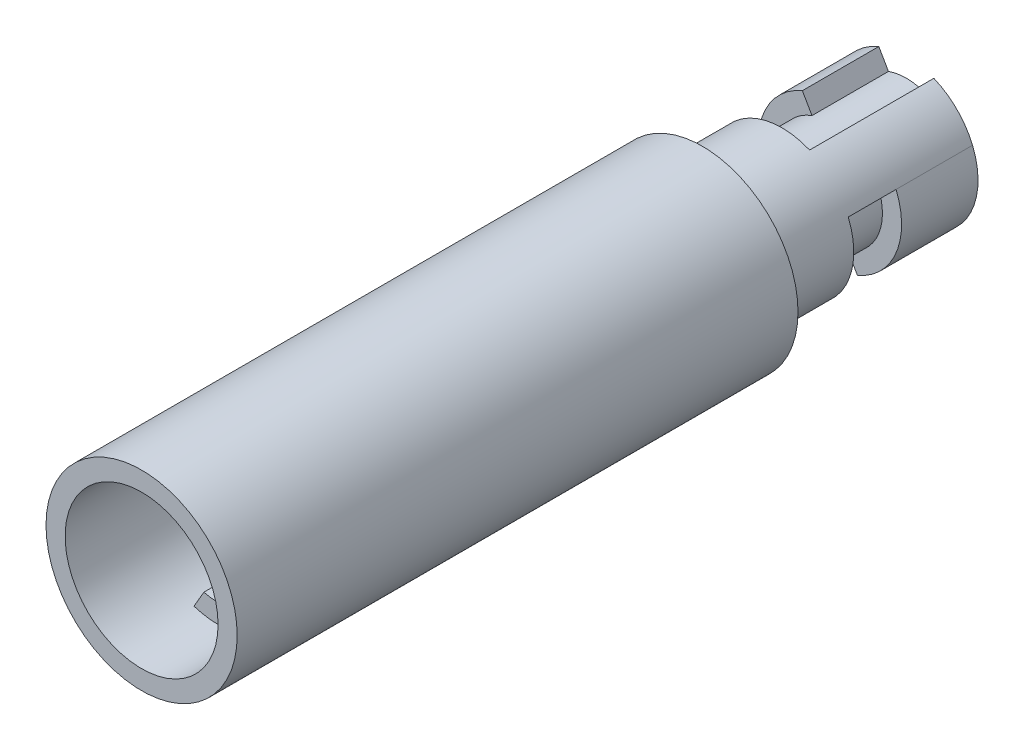
from build123d import *

# Parameters (mm, degrees)
SKETCH1_R           = 6.35
BOSS_EXTRUDE1_DEPTH = 38.1
SKETCH7_R           = 4.7625
BOSS_EXTRUDE2_DEPTH = 12.7
SKETCH8_R           = 5.08
CUT_EXTRUDE1_DEPTH  = 12.7
BOSS_EXTRUDE3_START = -5.08
BOSS_EXTRUDE3_DEPTH = 2.54
CUT_EXTRUDE2_START  = -8.255
CUT_EXTRUDE2_DEPTH  = 8.255
CUT_EXTRUDE3_START  = -8.255
CUT_EXTRUDE3_DEPTH  = 3.175
CUT_EXTRUDE8_START  = -0.846666667
SKETCH13_R          = 6.35
CUT_EXTRUDE8_DEPTH  = 0.846666667


with BuildPart() as part:
    # Sketch1 → Boss-Extrude1 (new body)
    with BuildSketch(Plane.XY):
        with Locations(Location((0, 0, 0), (0, 0, 180))):
            Circle(SKETCH1_R)
    extrude(amount=BOSS_EXTRUDE1_DEPTH)

    # Sketch7 → Boss-Extrude2 (add)
    with BuildSketch(Plane(origin=(0, 0, 0), x_dir=(-1, 0, 0), z_dir=(0, 0, -1))):
        Circle(SKETCH7_R)
    extrude(amount=BOSS_EXTRUDE2_DEPTH)

    # Sketch8 → Cut-Extrude1 (cut)
    with BuildSketch(Plane.XY.offset(38.1)):
        Circle(SKETCH8_R)
    extrude(amount=-CUT_EXTRUDE1_DEPTH, mode=Mode.SUBTRACT)

    # Sketch9 → Boss-Extrude3 (add)
    with BuildSketch(Plane.XY.offset(38.1).offset(BOSS_EXTRUDE3_START)):
        with BuildLine():
            ThreePointArc((-0.943437239, 3.691344765), (0, 3.81), (0.943437239, 3.691344765))
            Line((0.943437239, 3.691344765), (1.596562761, 4.822591352))
            ThreePointArc((1.596562761, 4.822591352), (0, 5.08), (-1.596562761, 4.822591352))
            Line((-1.596562761, 4.822591352), (-0.943437239, 3.691344765))
        make_face()
        with BuildLine():
            Line((1.596562761, -4.822591352), (0.943437239, -3.691344765))
            ThreePointArc((0.943437239, -3.691344765), (0, -3.81), (-0.943437239, -3.691344765))
            Line((-0.943437239, -3.691344765), (-1.596562761, -4.822591352))
            ThreePointArc((-1.596562761, -4.822591352), (0, -5.08), (1.596562761, -4.822591352))
        make_face()
    extrude(amount=-BOSS_EXTRUDE3_DEPTH)

    # Sketch10 → Cut-Extrude2 (cut)
    with BuildSketch(Plane(origin=(0, 0, -12.7), x_dir=(-1, 0, 0), z_dir=(0, 0, -1)).offset(CUT_EXTRUDE2_START)):
        with BuildLine():
            Line((1.828672286, -4.397426966), (1.186321903, -3.284843465))
            ThreePointArc((1.186321903, -3.284843465), (0, -3.4925), (-1.186321903, -3.284843465))
            Line((-1.186321903, -3.284843465), (-1.828672286, -4.397426966))
            ThreePointArc((-1.828672286, -4.397426966), (0, -4.7625), (1.828672286, -4.397426966))
        make_face()
        with BuildLine():
            ThreePointArc((-1.186321903, 3.284843465), (0, 3.4925), (1.186321903, 3.284843465))
            Line((1.186321903, 3.284843465), (1.828672286, 4.397426966))
            ThreePointArc((1.828672286, 4.397426966), (0, 4.7625), (-1.828672286, 4.397426966))
            Line((-1.828672286, 4.397426966), (-1.186321903, 3.284843465))
        make_face()
    extrude(amount=CUT_EXTRUDE2_DEPTH, mode=Mode.SUBTRACT)

    # Sketch11 → Cut-Extrude3 (cut)
    with BuildSketch(Plane(origin=(0, 0, -12.7), x_dir=(-1, 0, 0), z_dir=(0, 0, -1)).offset(CUT_EXTRUDE3_START)):
        with BuildLine():
            ThreePointArc((1.828672286, 4.397426966), (0, 4.7625), (-1.828672286, 4.397426966))
            Line((-1.828672286, 4.397426966), (-1.186321903, 3.284843465))
            ThreePointArc((-1.186321903, 3.284843465), (0, 3.4925), (1.186321903, 3.284843465))
            Line((1.186321903, 3.284843465), (1.828672286, 4.397426966))
        make_face()
        with BuildLine():
            Line((1.828672286, 4.397426966), (1.186321903, 3.284843465))
            ThreePointArc((1.186321903, 3.284843465), (2.469570433, 2.469570433), (3.284843465, 1.186321903))
            ThreePointArc((3.284843465, 1.186321903), (3.440194184, 0.602179561), (3.4925, 0))
            ThreePointArc((3.4925, 0), (3.440194184, -0.602179561), (3.284843465, -1.186321903))
            Line((3.284843465, -1.186321903), (4.397426966, -1.828672286))
            ThreePointArc((4.397426966, -1.828672286), (4.67034004, -0.932378766), (4.7625, 0))
            ThreePointArc((4.7625, 0), (4.67034004, 0.932378766), (4.397426966, 1.828672286))
            ThreePointArc((4.397426966, 1.828672286), (3.367596045, 3.367596045), (1.828672286, 4.397426966))
        make_face()
        with BuildLine():
            ThreePointArc((-1.828672286, -4.397426966), (0, -4.7625), (1.828672286, -4.397426966))
            Line((1.828672286, -4.397426966), (1.186321903, -3.284843465))
            ThreePointArc((1.186321903, -3.284843465), (0, -3.4925), (-1.186321903, -3.284843465))
            Line((-1.186321903, -3.284843465), (-1.828672286, -4.397426966))
        make_face()
        with BuildLine():
            ThreePointArc((-3.284843465, -1.186321903), (-3.4925, 0), (-3.284843465, 1.186321903))
            Line((-3.284843465, 1.186321903), (-4.397426966, 1.828672286))
            ThreePointArc((-4.397426966, 1.828672286), (-4.7625, 0), (-4.397426966, -1.828672286))
            ThreePointArc((-4.397426966, -1.828672286), (-3.367596045, -3.367596045), (-1.828672286, -4.397426966))
            Line((-1.828672286, -4.397426966), (-1.186321903, -3.284843465))
            ThreePointArc((-1.186321903, -3.284843465), (-2.469570433, -2.469570433), (-3.284843465, -1.186321903))
        make_face()
    extrude(amount=CUT_EXTRUDE3_DEPTH, mode=Mode.SUBTRACT)

    # Sketch13 → Cut-Extrude8 (cut)
    with BuildSketch(Plane(origin=(0, 0, 0), x_dir=(-1, 0, 0), z_dir=(0, 0, -1)).offset(CUT_EXTRUDE8_START)):
        Circle(SKETCH13_R)
        with BuildLine():
            ThreePointArc((1.828672286, 4.397426966), (3.96172046, 2.643137765), (4.7625, 0))
            ThreePointArc((4.7625, 0), (3.96172046, -2.643137765), (1.828672286, -4.397426966))
            ThreePointArc((1.828672286, -4.397426966), (-4.7625, 0), (1.828672286, 4.397426966))
        make_face(mode=Mode.SUBTRACT)
    extrude(amount=CUT_EXTRUDE8_DEPTH, mode=Mode.SUBTRACT)


solid = part.part
